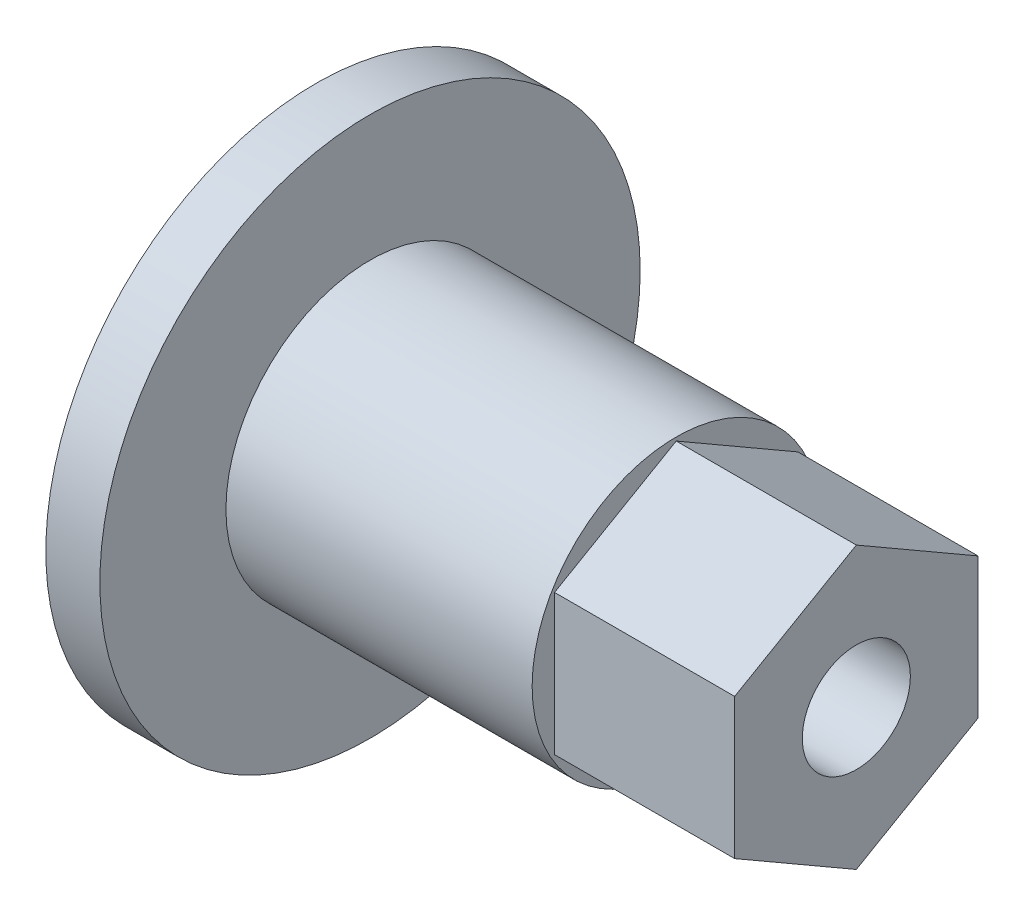
from build123d import *

# Parameters (mm, degrees)
SKETCH2_OUTSIDE_W               = 22.196
SKETCH2_OUTSIDE_H               = 22.196
CUT_EXTRUDE1_DEPTH              = 5
M3X0_5_TAPPED_HOLE4_D           = 2.5
M3X0_5_TAPPED_HOLE4_DEPTH       = 8.5
M3X0_5_TAPPED_HOLE4_CBORE_D     = 3
M3X0_5_TAPPED_HOLE4_CBORE_DEPTH = 6
M3X0_5_TAPPED_HOLE4_TIP         = 0.751075774
SKETCH7_R                       = 1.58496
CUT_EXTRUDE2_DEPTH              = 6.35


with BuildPart() as part:
    # Sketch1 → Revolve1 (revolve)
    with BuildSketch(Plane(origin=(0, 0, 0), x_dir=(1, 0, 0), z_dir=(0, 1, 0))):
        Polygon((1.5, 4), (15, 4), (15, 0), (0, 0), (0, 7.5), (1.5, 7.5), align=None)
    revolve(axis=Axis((15, 0, 0), (-1, 0, 0)))

    # Sketch2 outside → Cut-Extrude1 (cut)
    with BuildSketch(Plane(origin=(15, 0, 0), x_dir=(0, 0, -1), z_dir=(1, 0, 0))):
        Rectangle(SKETCH2_OUTSIDE_W, SKETCH2_OUTSIDE_H)
        Polygon((0, 3.9), (-3.377499075, 1.95), (-3.377499075, -1.95), (0, -3.9), (3.377499075, -1.95), (3.377499075, 1.95), align=None, mode=Mode.SUBTRACT)
    extrude(amount=-CUT_EXTRUDE1_DEPTH, mode=Mode.SUBTRACT)

    # M3x0.5 Tapped Hole4
    with Locations(Plane(origin=(15, 0, 0), x_dir=(0, 0, -1), z_dir=(1, 0, 0))):
        with Locations((0, 0)):
            CounterBoreHole(M3X0_5_TAPPED_HOLE4_D / 2, M3X0_5_TAPPED_HOLE4_CBORE_D / 2, M3X0_5_TAPPED_HOLE4_CBORE_DEPTH, depth=M3X0_5_TAPPED_HOLE4_DEPTH)
            with Locations((0, 0, -(M3X0_5_TAPPED_HOLE4_DEPTH + M3X0_5_TAPPED_HOLE4_TIP / 2))):  # 118° drill point
                Cone(0, M3X0_5_TAPPED_HOLE4_D / 2, M3X0_5_TAPPED_HOLE4_TIP, mode=Mode.SUBTRACT)

    # Sketch7 → Cut-Extrude2 (cut)
    with BuildSketch(Plane.ZY):
        Circle(SKETCH7_R)
    extrude(amount=-CUT_EXTRUDE2_DEPTH, mode=Mode.SUBTRACT)


solid = part.part
